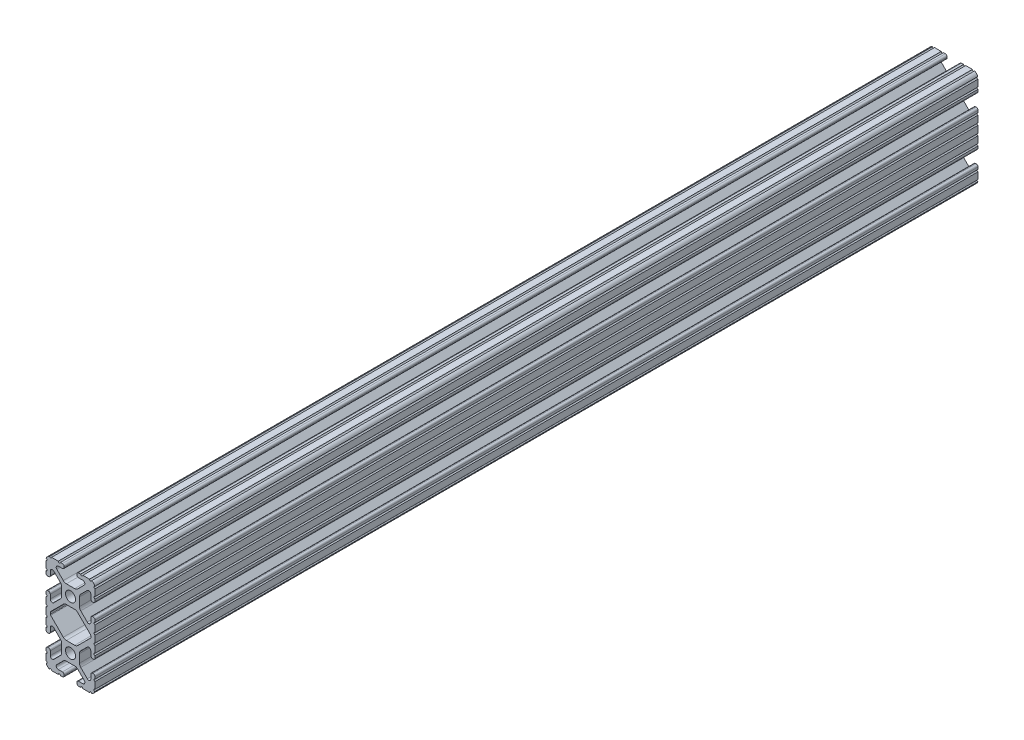
from build123d import *

# Parameters (mm, degrees)
BOSS_EXTRUDE1_DEPTH     = 228.6
CUT_EXTRUDE1_DEPTH      = 231.35713577
CUT_EXTRUDE1_DEPTH_BACK = 231.35713577
SKETCH5_R               = 0.55245
BOSS_EXTRUDE2_DEPTH     = 228.6
CUT_EXTRUDE2_DEPTH      = 231.35713577
CUT_EXTRUDE2_DEPTH_BACK = 231.35713577


with BuildPart() as part:
    # Sketch4 → Boss-Extrude1 (new, symmetric)
    with BuildSketch(Plane.XY):
        with BuildLine():
            Line((4.190365, -25.4), (10.11729625, -25.4))
            ThreePointArc((10.11729625, -25.4), (11.943543585, -24.643543585), (12.7, -22.81729625))
            Line((12.7, -22.81729625), (12.7, -16.890365))
            ThreePointArc((12.7, -16.890365), (12.42492494, -16.22627506), (11.760835, -15.9512))
            Line((11.760835, -15.9512), (11.429365, -15.9512))
            ThreePointArc((11.429365, -15.9512), (10.76527506, -16.22627506), (10.4902, -16.890365))
            Line((10.4902, -16.890365), (10.4902, -19.048478019))
            ThreePointArc((10.4902, -19.048478019), (9.830707141, -20.035478831), (8.666460301, -19.803895736))
            Line((8.666460301, -19.803895736), (5.299899128, -16.437334563))
            ThreePointArc((5.299899128, -16.437334563), (4.817571085, -15.715479634), (4.6482, -14.86399369))
            Line((4.6482, -14.86399369), (4.6482, -12.7))
            Line((4.6482, -12.7), (2.6035, -12.7))
            ThreePointArc((2.6035, -12.7), (1.840952505, -14.540952505), (0, -15.3035))
            Line((0, -15.3035), (0, -17.3482))
            Line((0, -17.3482), (2.16399369, -17.3482))
            ThreePointArc((2.16399369, -17.3482), (3.015479634, -17.517571085), (3.737334563, -17.999899128))
            Line((3.737334563, -17.999899128), (7.103895736, -21.366460301))
            ThreePointArc((7.103895736, -21.366460301), (7.335478831, -22.530707141), (6.348478019, -23.1902))
            Line((6.348478019, -23.1902), (4.190365, -23.1902))
            ThreePointArc((4.190365, -23.1902), (3.52627506, -23.46527506), (3.2512, -24.129365))
            Line((3.2512, -24.129365), (3.2512, -24.460835))
            ThreePointArc((3.2512, -24.460835), (3.52627506, -25.12492494), (4.190365, -25.4))
        make_face()
    extrude(amount=BOSS_EXTRUDE1_DEPTH, both=True)

    # Sketch5 → Cut-Extrude1 (cut, two sides: drawn at the far end of the back side and taken through both)
    with BuildSketch(Plane.XY.offset(-CUT_EXTRUDE1_DEPTH_BACK)):
        with Locations((10.356153152, -25.4)):
            Circle(SKETCH5_R)
        with Locations((5.796028019, -25.4)):
            Circle(SKETCH5_R)
        with Locations((12.7, -23.056153152)):
            Circle(SKETCH5_R)
        with Locations((12.7, -18.496028019)):
            Circle(SKETCH5_R)
    extrude(amount=CUT_EXTRUDE1_DEPTH + CUT_EXTRUDE1_DEPTH_BACK, mode=Mode.SUBTRACT)

    # Mirror1: part across plane


with BuildPart() as part_1:
    add(part.part)
    add(part.part.mirror(Plane(origin=(4.6482, -12.7, 228.6), x_dir=(0, 0, 1), z_dir=(0, -1, 0))))

    # Sketch6 → Boss-Extrude2 (add, symmetric)
    with BuildSketch(Plane.XY):
        with BuildLine():
            Line((12.7, -1.791396848), (12.7, 0))
            Line((12.7, 0), (9.803703152, 0))
            Line((9.803703152, 0), (9.803703152, -2.343846848))
            Line((9.803703152, -2.343846848), (12.14755, -2.343846848))
            ThreePointArc((12.14755, -2.343846848), (12.309358859, -1.953205706), (12.7, -1.791396848))
        make_face()
    extrude(amount=BOSS_EXTRUDE2_DEPTH, both=True)

    # Sketch7 → Cut-Extrude2 (cut, two sides: drawn at the far end of the back side and taken through both)
    with BuildSketch(Plane.XY.offset(-CUT_EXTRUDE2_DEPTH_BACK)):
        with BuildLine():
            Line((5.420615149, -5.716820286), (10.328391141, -0.809044294))
            ThreePointArc((10.328391141, -0.809044294), (10.448147248, -0.629816615), (10.4902, -0.418403152))
            Line((10.4902, -0.418403152), (10.4902, 0))
            Line((10.4902, 0), (0, 0))
            Line((0, 0), (5.420615149, -5.716820286))
        make_face()
    extrude(amount=CUT_EXTRUDE2_DEPTH + CUT_EXTRUDE2_DEPTH_BACK, mode=Mode.SUBTRACT)

    # Mirror2: part across plane


with BuildPart() as part_2:
    add(part_1.part)
    add(part_1.part.mirror(Plane.ZX))

    # Mirror3: part across plane


with BuildPart() as part_3:
    add(part_2.part)
    add(part_2.part.mirror(Plane(origin=(0, 0, 0), x_dir=(0, 0, 1), z_dir=(1, 0, 0))))


solid = part_3.part
